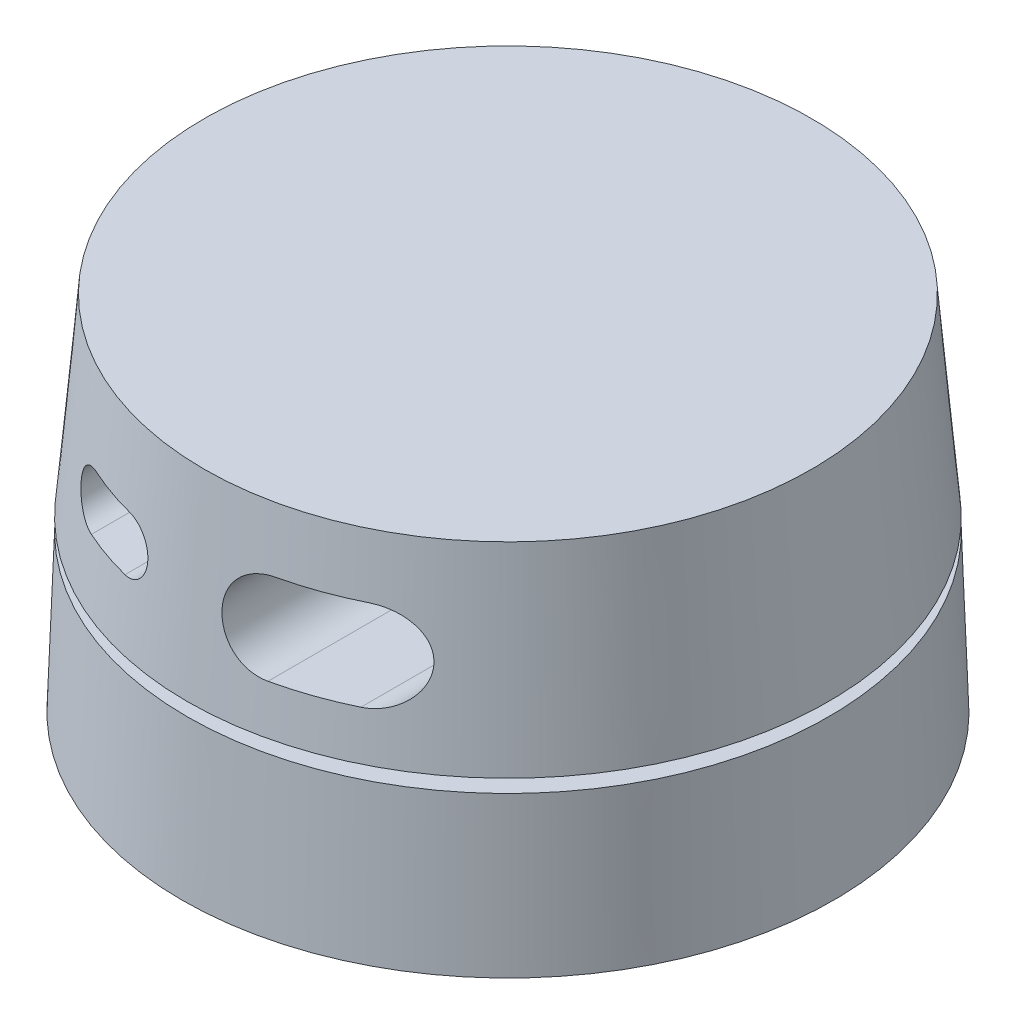
from build123d import *

# Parameters (mm, degrees)
SKETCH_1_R          = 37.83
EXTRUDE_1_DEPTH     = 18.1
DRAFT_1_ANGLE       = -2
SKETCH_3_R          = 34
EXTRUDE_2_DEPTH     = 1.53
SKETCH_4_R          = 37.197934072
EXTRUDE_3_DEPTH     = 22.37
DRAFT_2_ANGLE       = -5
SKETCH_5_R          = 1.5
CUT_EXTRUDE_1_DEPTH = 10
CUT_EXTRUDE_2_DEPTH = 30


with BuildPart() as part:
    # 草图1 → 凸台-拉伸1 (new body)
    with BuildSketch(Plane(origin=(0, 0, 0), x_dir=(1, 0, 0), z_dir=(0, 1, 0))):
        with Locations(Location((0, 0, 0), (0, 0, 90))):
            Circle(SKETCH_1_R)
    extrude(amount=EXTRUDE_1_DEPTH)

    # 拔模1
    draft_1_faces = [part.faces().sort_by_distance(p)[0] for p in [
        (0, 9.05, 37.83),
    ]]
    draft(draft_1_faces, Plane(origin=(0, 0, 0), x_dir=(0, 0, -1), z_dir=(0, -1, 0)), DRAFT_1_ANGLE)

    # 草图3 → 凸台-拉伸2 (add)
    with BuildSketch(Plane(origin=(0, 18.1, 0), x_dir=(1, 0, 0), z_dir=(0, 1, 0))):
        with Locations(Location((0, 0, 0), (0, 0, 270))):
            Circle(SKETCH_3_R)
    extrude(amount=EXTRUDE_2_DEPTH)

    # 草图4 → 凸台-拉伸3 (add)
    with BuildSketch(Plane(origin=(0, 19.63, 0), x_dir=(1, 0, 0), z_dir=(0, 1, 0))):
        with Locations(Location((0, 0, 0), (0, 0, 270))):
            Circle(SKETCH_4_R)
    extrude(amount=EXTRUDE_3_DEPTH)

    # 拔模2
    draft_2_faces = [part.faces().sort_by_distance(p)[0] for p in [
        (0, 30.815, -37.197934072),
    ]]
    draft(draft_2_faces, Plane(origin=(0, 19.63, 0), x_dir=(0, 0, -1), z_dir=(0, -1, 0)), DRAFT_2_ANGLE)

    # 草图5 → 切除-拉伸1 (cut)
    with BuildSketch(Plane.XZ):
        with Locations(Location((29, 0, 0), (0, 0, 270))):
            Circle(SKETCH_5_R)
        with Locations(Location((-29, 0, 0), (0, 0, 90))):
            Circle(SKETCH_5_R)
        with Locations(Location((0, 29, 0), (0, 0, 270))):
            Circle(SKETCH_5_R)
        with Locations(Location((0, -29, 0), (0, 0, 90))):
            Circle(SKETCH_5_R)
    extrude(amount=-CUT_EXTRUDE_1_DEPTH, mode=Mode.SUBTRACT)

    # 草图6 → 切除-拉伸2 (cut)
    with BuildSketch(Plane.XY.offset(40)):
        with BuildLine():
            Line((8, 35), (16, 35))
            ThreePointArc((16, 35), (21, 30), (16, 25))
            Line((16, 25), (8, 25))
            ThreePointArc((8, 25), (3, 30), (8, 35))
        make_face()
        with BuildLine():
            Line((-15, 33), (-9, 33))
            ThreePointArc((-9, 33), (-6, 30), (-9, 27))
            Line((-9, 27), (-15, 27))
            ThreePointArc((-15, 27), (-18, 30), (-15, 33))
        make_face()
    extrude(amount=-CUT_EXTRUDE_2_DEPTH, mode=Mode.SUBTRACT)


solid = part.part
